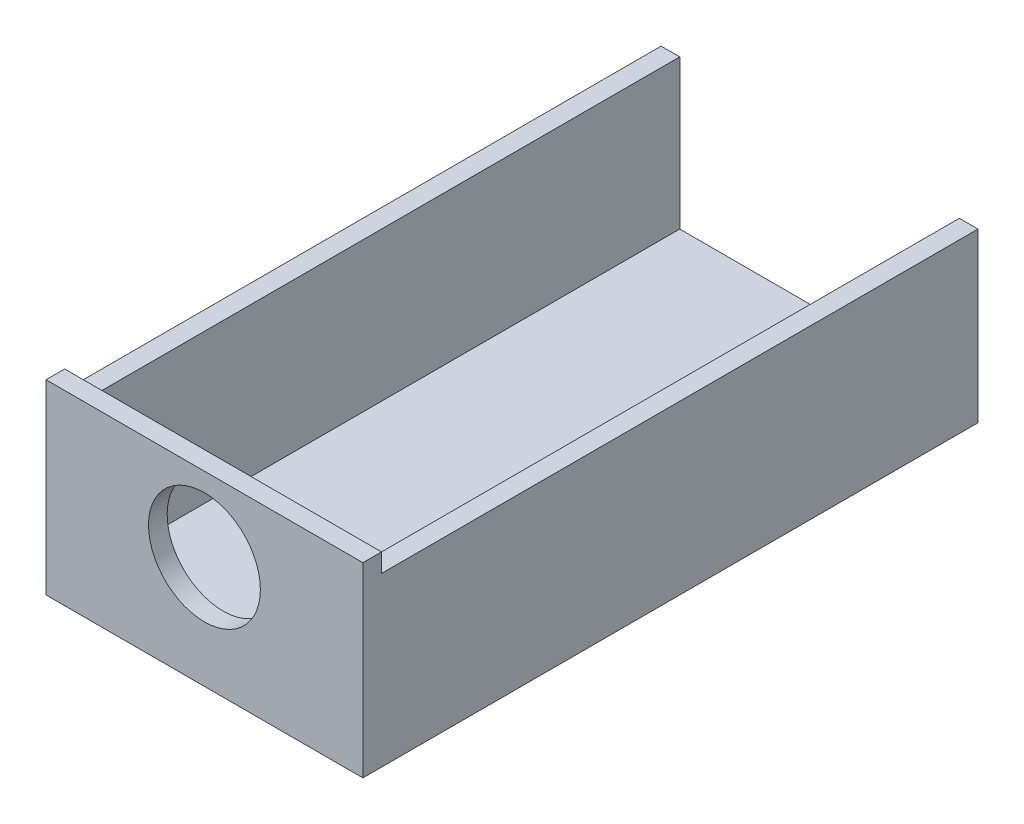
from build123d import *

# Parameters (mm, degrees)
SKETCH_1_W          = 17
SKETCH_1_H          = 33
EXTRUDE_1_DEPTH     = 10
CUT_EXTRUDE_START   = 1
SKETCH_2_W          = 15
SKETCH_2_H          = 32
CUT_EXTRUDE_1_DEPTH = 8
SKETCH_3_R          = 3
CUT_EXTRUDE_2_DEPTH = 22.083168642
CUT_EXTRUDE_START_2 = 9
SKETCH_5_W          = 17
SKETCH_5_H          = 32
CUT_EXTRUDE_3_DEPTH = 8
EXTRUDE_START       = 9
SKETCH_6_W          = 17
SKETCH_6_H          = 32
EXTRUDE_2_DEPTH     = 1
SKETCH_7_W          = 17
SKETCH_7_H          = 32
CUT_EXTRUDE_4_DEPTH = 1


with BuildPart() as part:
    # 스케치1 → 보스-돌출1 (new body)
    with BuildSketch(Plane(origin=(0, 0, 0), x_dir=(1, 0, 0), z_dir=(0, 1, 0))):
        Rectangle(SKETCH_1_W, SKETCH_1_H)
    extrude(amount=EXTRUDE_1_DEPTH)

    # 스케치2 → 컷-돌출1 (cut)
    with BuildSketch(Plane(origin=(0, 0, 0), x_dir=(1, 0, 0), z_dir=(0, 1, 0)).offset(CUT_EXTRUDE_START)):
        with Locations((0, 0.5)):
            Rectangle(SKETCH_2_W, SKETCH_2_H)
    extrude(amount=CUT_EXTRUDE_1_DEPTH, mode=Mode.SUBTRACT)

    # 스케치3 → 컷-돌출2 (cut, through all)
    with BuildSketch(Plane.XY):
        with Locations(Location((0, 6, 0), (0, 0, 90))):
            Circle(SKETCH_3_R)
    extrude(amount=CUT_EXTRUDE_2_DEPTH, mode=Mode.SUBTRACT)

    # 스케치5 → 컷-돌출3 (cut)
    with BuildSketch(Plane(origin=(0, 0, 0), x_dir=(1, 0, 0), z_dir=(0, 1, 0)).offset(CUT_EXTRUDE_START_2)):
        with Locations((0, 0.5)):
            Rectangle(SKETCH_5_W, SKETCH_5_H)
    extrude(amount=CUT_EXTRUDE_3_DEPTH, mode=Mode.SUBTRACT)


with BuildPart() as body_2:
    # 스케치6 → 보스-돌출2 (new body)
    with BuildSketch(Plane(origin=(0, 0, 0), x_dir=(1, 0, 0), z_dir=(0, 1, 0)).offset(EXTRUDE_START)):
        with Locations((0, 0.5)):
            Rectangle(SKETCH_6_W, SKETCH_6_H)
    extrude(amount=EXTRUDE_2_DEPTH)

    # 스케치7 → 컷-돌출4 (cut)
    with BuildSketch(Plane(origin=(0, 10, 0), x_dir=(1, 0, 0), z_dir=(0, 1, 0))):
        with Locations((0, 0.5)):
            Rectangle(SKETCH_7_W, SKETCH_7_H)
    extrude(amount=-CUT_EXTRUDE_4_DEPTH, mode=Mode.SUBTRACT)


solid = part.part
